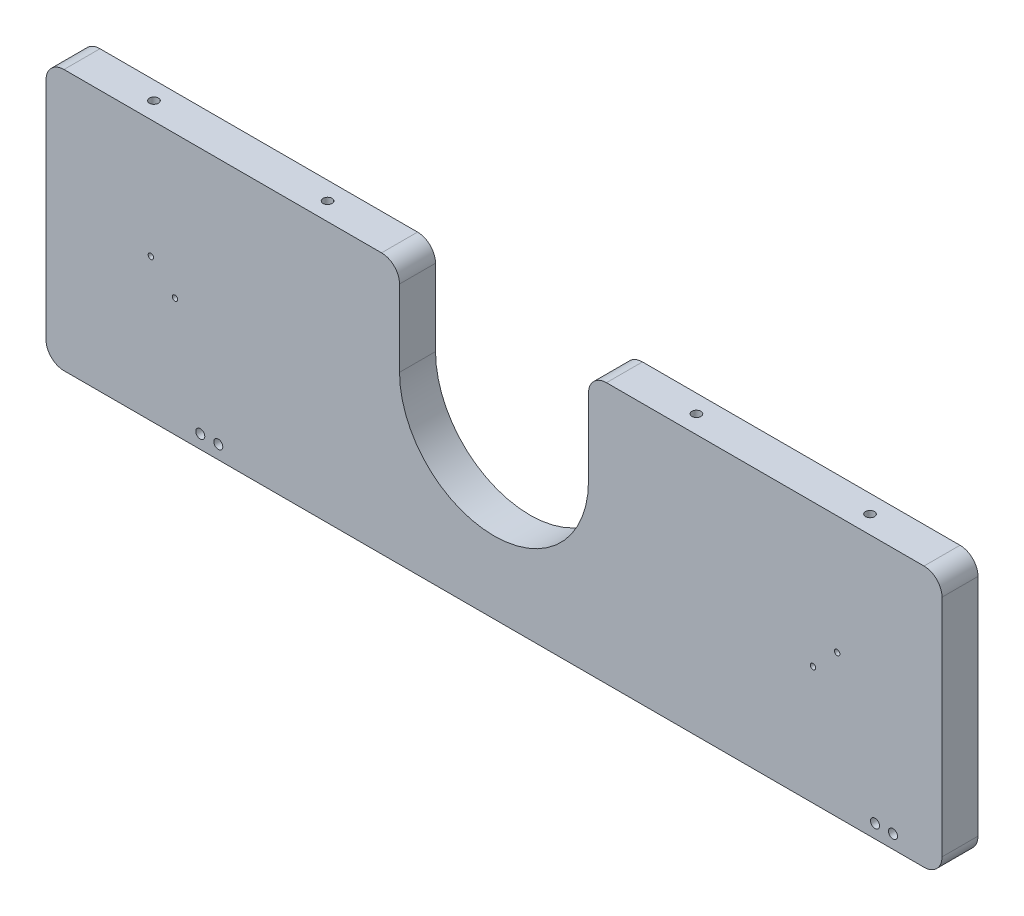
from build123d import *

# Parameters (mm, degrees)
SKETCH1_R           = 2.5
BOSS_EXTRUDE1_DEPTH = 20
FILLET1_R           = 10
SKETCH2_R           = 1.5
CUT_EXTRUDE1_DEPTH  = 20
SKETCH3_R           = 2.5
CUT_EXTRUDE2_DEPTH  = 10
FILLET2_R           = 10


with BuildPart() as part:
    # Sketch1 → Boss-Extrude1 (new body)
    with BuildSketch(Plane.XY):
        with BuildLine():
            Line((52.5, 20.781588347), (249, 20.781588347))
            Line((249, 20.781588347), (249, -124.218411653))
            Line((249, -124.218411653), (-249, -124.218411653))
            Line((-249, -124.218411653), (-249, 20.781588347))
            Line((-249, 20.781588347), (-52.5, 20.781588347))
            Line((-52.5, 20.781588347), (-52.5, -31.718411653))
            ThreePointArc((-52.5, -31.718411653), (0, -84.218411653), (52.5, -31.718411653))
            Line((52.5, -31.718411653), (52.5, 20.781588347))
        make_face()
        with Locations((-163.25, -116.718411653)):
            Circle(SKETCH1_R, mode=Mode.SUBTRACT)
        with Locations((-153.25, -116.718411653)):
            Circle(SKETCH1_R, mode=Mode.SUBTRACT)
        with Locations((211.75, -116.718411653)):
            Circle(SKETCH1_R, mode=Mode.SUBTRACT)
        with Locations((221.75, -116.718411653)):
            Circle(SKETCH1_R, mode=Mode.SUBTRACT)
    extrude(amount=BOSS_EXTRUDE1_DEPTH)

    # Fillet1
    fillet1_edges = [part.edges().sort_by_distance(p)[0] for p in [
        (249, -124.218411653, 10),
        (-249, -124.218411653, 10),
    ]]
    fillet(fillet1_edges, radius=FILLET1_R)

    # Sketch2 → Cut-Extrude1 (cut)
    with BuildSketch(Plane.XY.offset(20)):
        with Locations((-177.282485579, -58.435926074)):
            Circle(SKETCH2_R)
        with Locations((-190.717514421, -45.000897232)):
            Circle(SKETCH2_R)
        with Locations((190.717514421, -45.000897232)):
            Circle(SKETCH2_R)
        with Locations((177.282485579, -58.435926074)):
            Circle(SKETCH2_R)
    extrude(amount=-CUT_EXTRUDE1_DEPTH, mode=Mode.SUBTRACT)

    # Sketch3 → Cut-Extrude2 (cut)
    with BuildSketch(Plane(origin=(0, 20.781588347, 0), x_dir=(1, 0, 0), z_dir=(0, 1, 0))):
        with Locations(Location((-199, -10, 0), (0, 0, 180))):
            Circle(SKETCH3_R)
        with Locations(Location((-102.5, -10, 0), (0, 0, 180))):
            Circle(SKETCH3_R)
        with Locations((102.5, -10)):
            Circle(SKETCH3_R)
        with Locations((199, -10)):
            Circle(SKETCH3_R)
    extrude(amount=-CUT_EXTRUDE2_DEPTH, mode=Mode.SUBTRACT)

    # Fillet2
    fillet2_edges = [part.edges().sort_by_distance(p)[0] for p in [
        (-249, 20.781588347, 10),
        (-52.5, 20.781588347, 10),
        (52.5, 20.781588347, 10),
        (249, 20.781588347, 10),
    ]]
    fillet(fillet2_edges, radius=FILLET2_R)


solid = part.part
